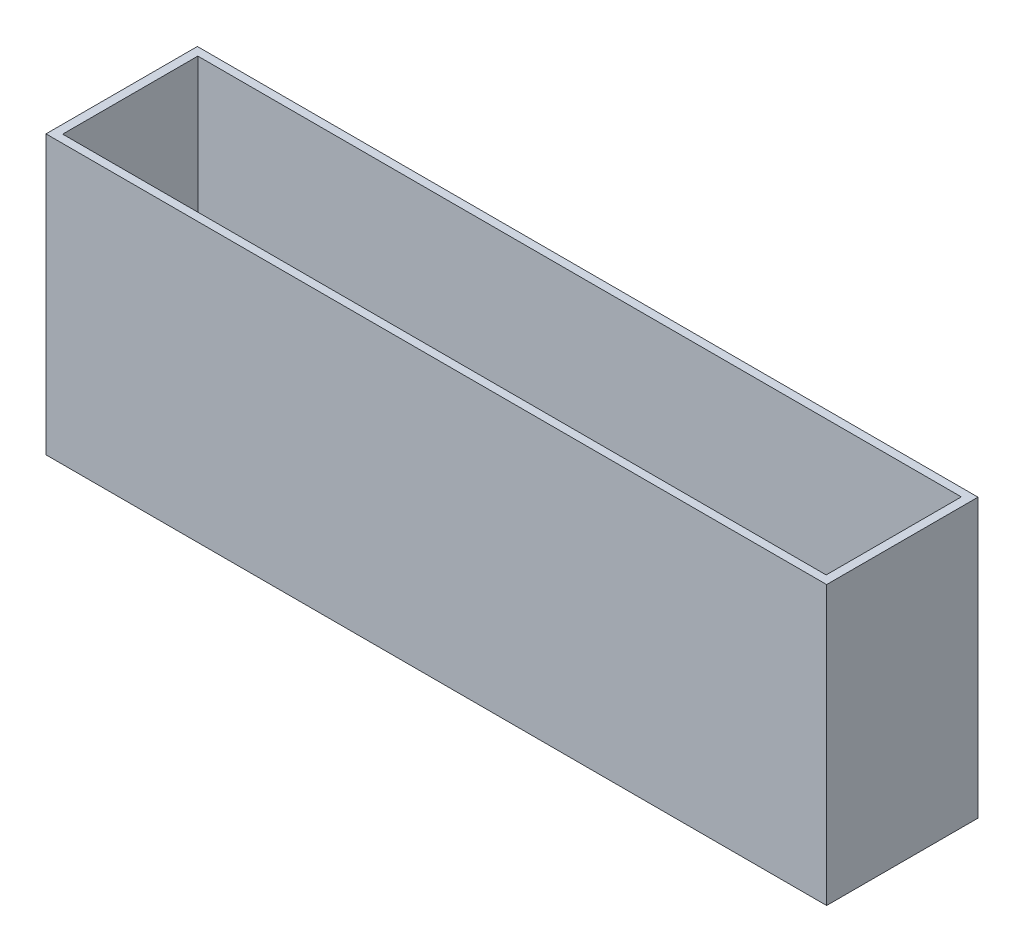
from build123d import *

# Parameters (mm, degrees)
SKETCH1_W           = 104.14
SKETCH1_H           = 20.193
BOSS_EXTRUDE1_DEPTH = 5.08
SKETCH2_W           = 104.14
SKETCH2_H           = 20.193
SKETCH2_W_2         = 101.854
SKETCH2_H_2         = 18.034
BOSS_EXTRUDE2_DEPTH = 32.004
SKETCH3_R           = 2.54
SKETCH3_W           = 33.02
SKETCH3_H           = 17.526
SKETCH3_W_2         = 17.526
CUT_EXTRUDE1_DEPTH  = 32.004


with BuildPart() as part:
    # Sketch1 → Boss-Extrude1 (new body)
    with BuildSketch(Plane(origin=(0, 0, 0), x_dir=(1, 0, 0), z_dir=(0, 1, 0))):
        Rectangle(SKETCH1_W, SKETCH1_H)
    extrude(amount=BOSS_EXTRUDE1_DEPTH)

    # Sketch2 → Boss-Extrude2 (add)
    with BuildSketch(Plane(origin=(0, 5.08, 0), x_dir=(1, 0, 0), z_dir=(0, 1, 0))):
        Rectangle(SKETCH2_W, SKETCH2_H)
        Rectangle(SKETCH2_W_2, SKETCH2_H_2, mode=Mode.SUBTRACT)
    extrude(amount=BOSS_EXTRUDE2_DEPTH)

    # Sketch3 → Cut-Extrude1 (cut)
    with BuildSketch(Plane(origin=(0, 5.08, 0), x_dir=(1, 0, 0), z_dir=(0, 1, 0))):
        with Locations(Location((11.303, 0, 0), (0, 0, 270))):
            Circle(SKETCH3_R)
        with Locations((-21.717, 0)):
            Rectangle(SKETCH3_W, SKETCH3_H)
        with Locations((37.084, 0)):
            Rectangle(SKETCH3_W_2, SKETCH3_H)
    extrude(amount=-CUT_EXTRUDE1_DEPTH, mode=Mode.SUBTRACT)


solid = part.part
